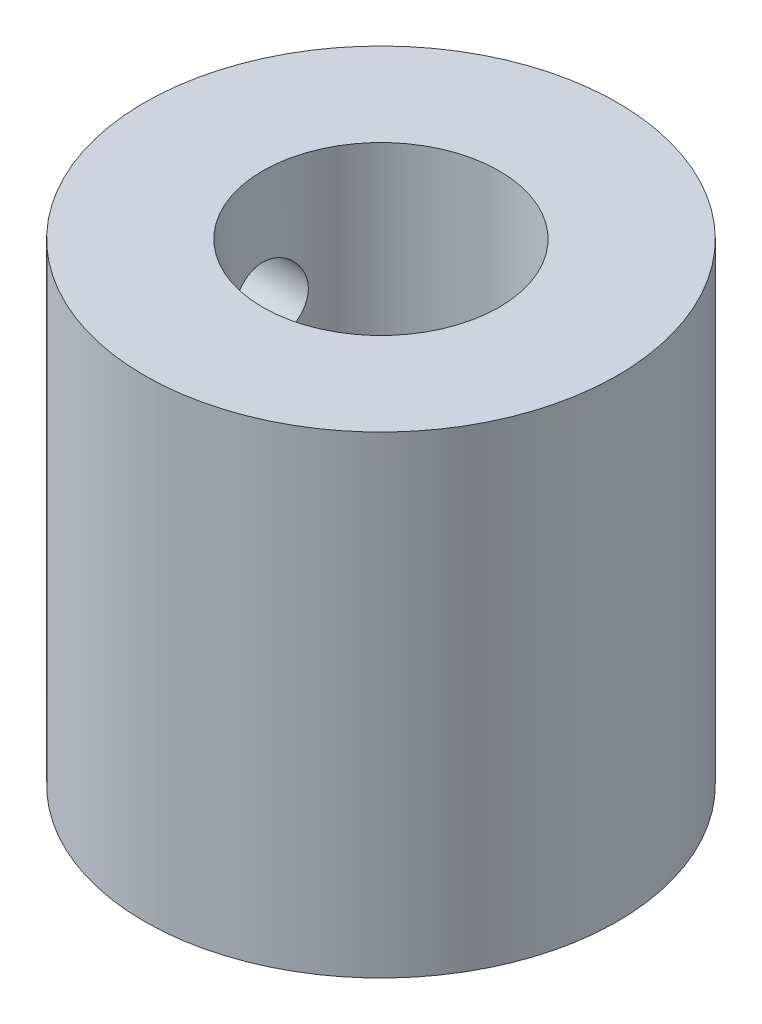
from build123d import *

# Parameters (mm, degrees)
SKETCH1_R           = 10
SKETCH1_R_2         = 4
BOSS_EXTRUDE1_DEPTH = 20
SKETCH2_R           = 5
CUT_EXTRUDE1_DEPTH  = 10
SKETCH3_R           = 1.65
CUT_EXTRUDE2_DEPTH  = 10


with BuildPart() as part:
    # Sketch1 → Boss-Extrude1 (new body)
    with BuildSketch(Plane(origin=(0, 0, 0), x_dir=(1, 0, 0), z_dir=(0, 1, 0))):
        with Locations(Location((0, 0, 0), (0, 0, 270))):
            Circle(SKETCH1_R)
        with Locations(Location((0, 0, 0), (0, 0, 270))):
            Circle(SKETCH1_R_2, mode=Mode.SUBTRACT)
    extrude(amount=BOSS_EXTRUDE1_DEPTH)

    # Sketch2 → Cut-Extrude1 (cut)
    with BuildSketch(Plane(origin=(0, 20, 0), x_dir=(1, 0, 0), z_dir=(0, 1, 0))):
        with Locations(Location((0, 0, 0), (0, 0, 270))):
            Circle(SKETCH2_R)
    extrude(amount=-CUT_EXTRUDE1_DEPTH, mode=Mode.SUBTRACT)

    # Sketch3 → Cut-Extrude2 (cut)
    with BuildSketch(Plane(origin=(0, 0, 0), x_dir=(0, 0, -1), z_dir=(1, 0, 0))):
        with Locations((0, 5)):
            Circle(SKETCH3_R)
        with Locations((0, 15)):
            Circle(SKETCH3_R)
    extrude(amount=-CUT_EXTRUDE2_DEPTH, mode=Mode.SUBTRACT)


solid = part.part
